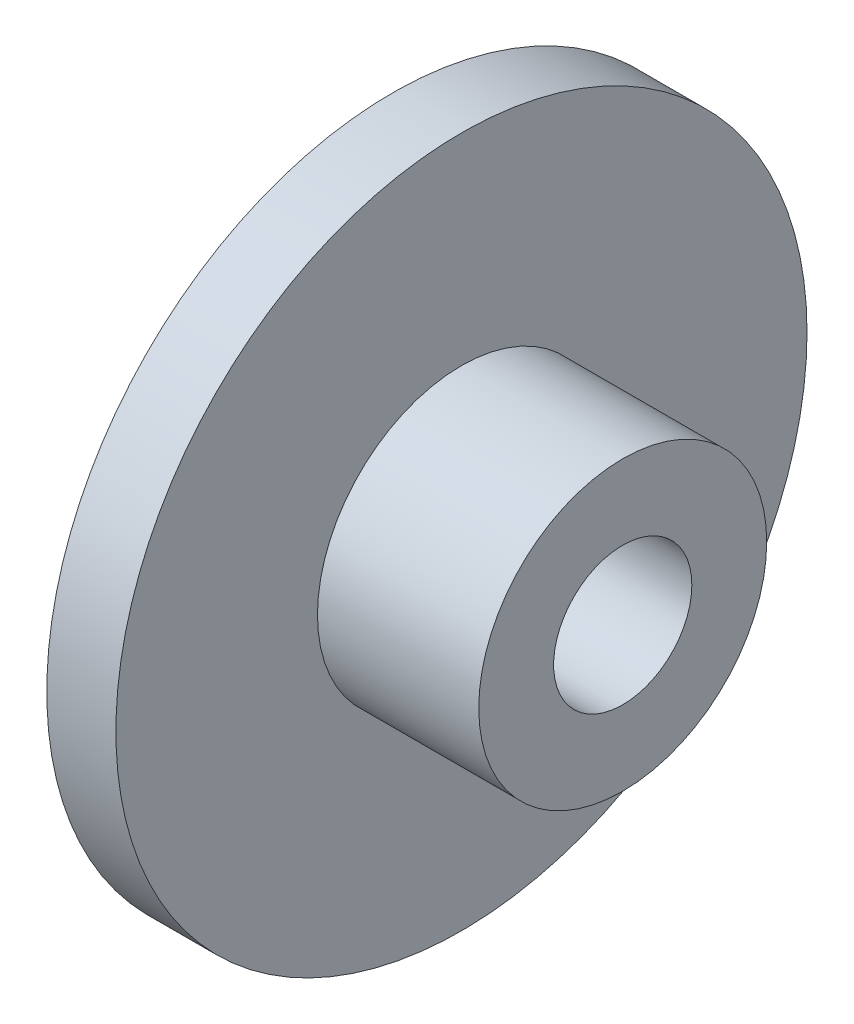
from build123d import *

# Parameters (mm, degrees)
SKETCH1_R           = 30
BOSS_EXTRUDE1_DEPTH = 3
SKETCH2_R           = 12.5
BOSS_EXTRUDE2_DEPTH = 14
SKETCH3_R           = 6
CUT_EXTRUDE1_DEPTH  = 47.904157598


with BuildPart() as part:
    # Sketch1 → Boss-Extrude1 (new, symmetric)
    with BuildSketch(Plane(origin=(0, 0, 0), x_dir=(0, 0, -1), z_dir=(1, 0, 0))):
        Circle(SKETCH1_R)
    extrude(amount=BOSS_EXTRUDE1_DEPTH, both=True)

    # Sketch2 → Boss-Extrude2 (add)
    with BuildSketch(Plane(origin=(3, 0, 0), x_dir=(0, 0, -1), z_dir=(1, 0, 0))):
        Circle(SKETCH2_R)
    extrude(amount=BOSS_EXTRUDE2_DEPTH)

    # Sketch3 → Cut-Extrude1 (cut, through all)
    with BuildSketch(Plane(origin=(17, 0, 0), x_dir=(0, 0, -1), z_dir=(1, 0, 0))):
        Circle(SKETCH3_R)
    extrude(amount=-CUT_EXTRUDE1_DEPTH, mode=Mode.SUBTRACT)


solid = part.part
